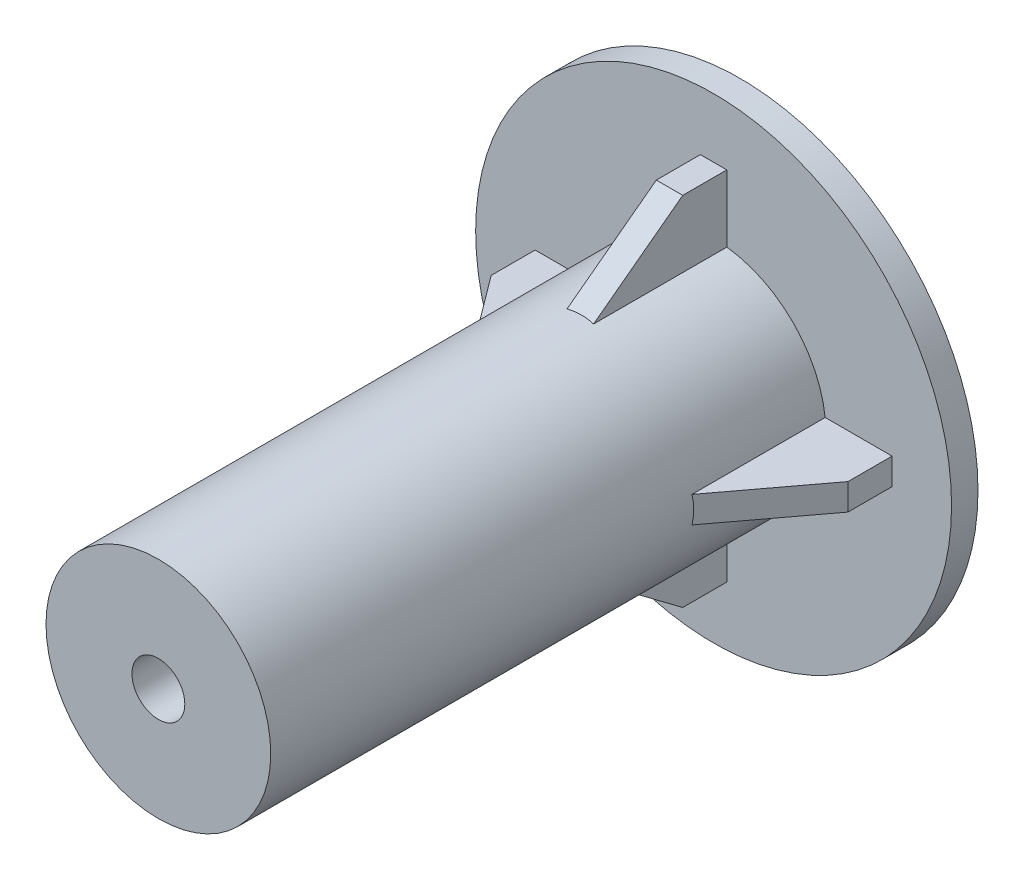
from build123d import *

# Parameters (mm, degrees)
SKETCH1_R           = 42.5
BOSS_EXTRUDE1_DEPTH = 210
SKETCH2_R           = 10
CUT_EXTRUDE1_DEPTH  = 20
SKETCH3_R           = 90
BOSS_EXTRUDE2_DEPTH = 10
RIB1_REACH          = 247.561
SKETCH4_WALL_W      = 555.621166312
SKETCH4_WALL_H      = 10
CIRPATTERN1_COUNT   = 4
SKETCH5_OUTSIDE_W   = 249.29
SKETCH5_OUTSIDE_H   = 249.29
SKETCH5_OUTSIDE_W_2 = 135
SKETCH5_OUTSIDE_H_2 = 135
CUT_EXTRUDE2_DEPTH  = 94


with BuildPart() as part:
    # Sketch1 → Boss-Extrude1 (new body)
    with BuildSketch(Plane.XY):
        Circle(SKETCH1_R)
    extrude(amount=BOSS_EXTRUDE1_DEPTH)

    # Sketch2 → Cut-Extrude1 (cut)
    with BuildSketch(Plane.XY.offset(210)):
        Circle(SKETCH2_R)
    extrude(amount=-CUT_EXTRUDE1_DEPTH, mode=Mode.SUBTRACT)

    # Sketch3 → Boss-Extrude2 (add)
    with BuildSketch(Plane(origin=(0, 0, 0), x_dir=(-1, 0, 0), z_dir=(0, 0, -1))):
        Circle(SKETCH3_R)
    extrude(amount=BOSS_EXTRUDE2_DEPTH)

    # Sketch4 wall → Rib1 (add, up to next)
    with BuildSketch(Plane(origin=(-61.25, 0, 25), x_dir=(-0.6, 0, -0.8), z_dir=(-0.8, 0, 0.6)), mode=Mode.PRIVATE) as rib1_sk1:
        Rectangle(SKETCH4_WALL_W, SKETCH4_WALL_H)
    rib1_tool1 = extrude(rib1_sk1.sketch, amount=-RIB1_REACH, mode=Mode.PRIVATE) - part.part
    rib1 = rib1_tool1.solids().sort_by_distance((-61.25, 0, 25))[0]
    add(rib1)

    # CirPattern1: Rib1 ×4 about axis
    cirpattern1_axis = Axis((0, 0, 0), (0, 0, 1))
    for i in range(1, CIRPATTERN1_COUNT):
        add(rib1.rotate(cirpattern1_axis, i * 360 / CIRPATTERN1_COUNT))

    # Sketch5 outside → Cut-Extrude2 (cut)
    with BuildSketch(Plane.XY):
        Rectangle(SKETCH5_OUTSIDE_W, SKETCH5_OUTSIDE_H)
        Rectangle(SKETCH5_OUTSIDE_W_2, SKETCH5_OUTSIDE_H_2, mode=Mode.SUBTRACT)
    extrude(amount=CUT_EXTRUDE2_DEPTH, mode=Mode.SUBTRACT)


solid = part.part
